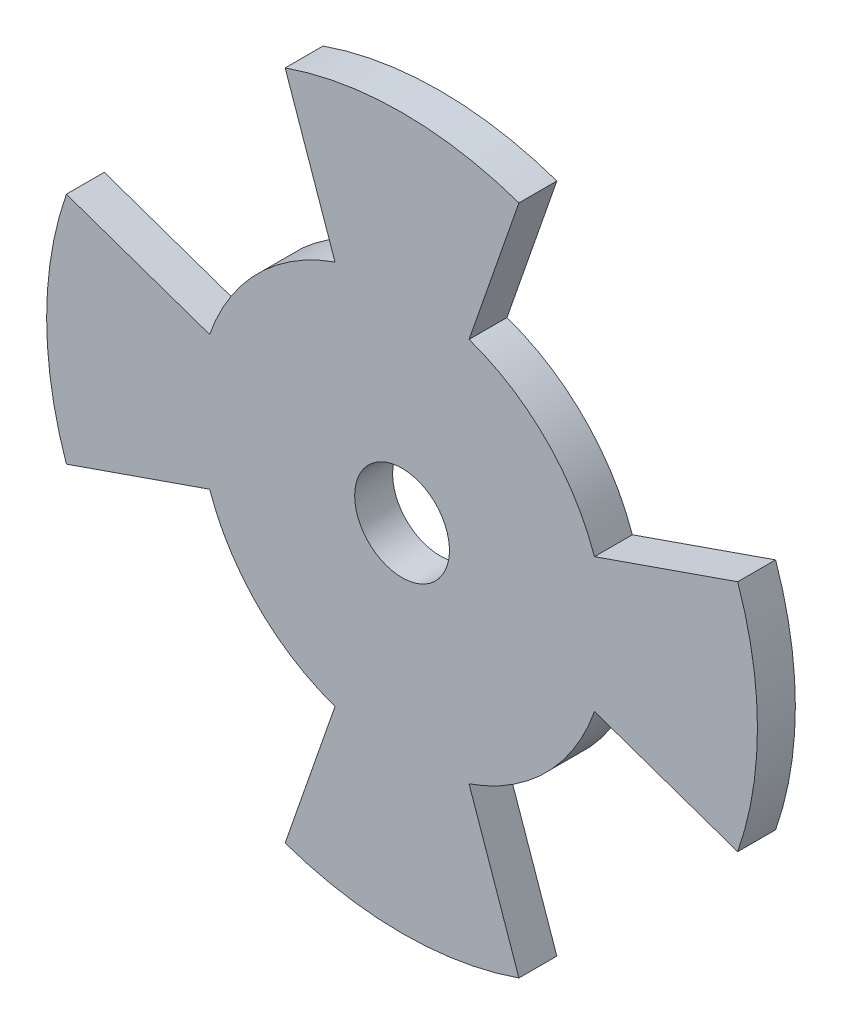
from build123d import *

# Parameters (mm, degrees)
BOSS_EXTRUDE1_DEPTH = 2
SKETCH2_R           = 2.5
CUT_EXTRUDE1_DEPTH  = 27.591822051


with BuildPart() as part:
    # Sketch1 → Boss-Extrude1 (new body)
    with BuildSketch(Plane.XY):
        with BuildLine():
            Line((3.535767004, 10.15188907), (6.167035471, 17.706783262))
            ThreePointArc((6.167035471, 17.706783262), (0, 18.75), (-6.167035471, 17.706783262))
            Line((-6.167035471, 17.706783262), (-3.535767004, 10.15188907))
            ThreePointArc((-3.535767004, 10.15188907), (-7.601397898, 7.601397898), (-10.15188907, 3.535767004))
            Line((-10.15188907, 3.535767004), (-17.706783262, 6.167035471))
            ThreePointArc((-17.706783262, 6.167035471), (-18.75, 0), (-17.706783262, -6.167035471))
            Line((-17.706783262, -6.167035471), (-10.15188907, -3.535767004))
            ThreePointArc((-10.15188907, -3.535767004), (-7.601397898, -7.601397898), (-3.535767004, -10.15188907))
            Line((-3.535767004, -10.15188907), (-6.167035471, -17.706783262))
            ThreePointArc((-6.167035471, -17.706783262), (0, -18.75), (6.167035471, -17.706783262))
            Line((6.167035471, -17.706783262), (3.535767004, -10.15188907))
            ThreePointArc((3.535767004, -10.15188907), (7.601397898, -7.601397898), (10.15188907, -3.535767004))
            Line((10.15188907, -3.535767004), (17.706783262, -6.167035471))
            ThreePointArc((17.706783262, -6.167035471), (18.75, 0), (17.706783262, 6.167035471))
            Line((17.706783262, 6.167035471), (10.15188907, 3.535767004))
            ThreePointArc((10.15188907, 3.535767004), (7.601397898, 7.601397898), (3.535767004, 10.15188907))
        make_face()
    extrude(amount=BOSS_EXTRUDE1_DEPTH)

    # Sketch2 → Cut-Extrude1 (cut, through all)
    with BuildSketch(Plane(origin=(0, 0, 0), x_dir=(-1, 0, 0), z_dir=(0, 0, -1))):
        Circle(SKETCH2_R)
    extrude(amount=-CUT_EXTRUDE1_DEPTH, mode=Mode.SUBTRACT)


solid = part.part
